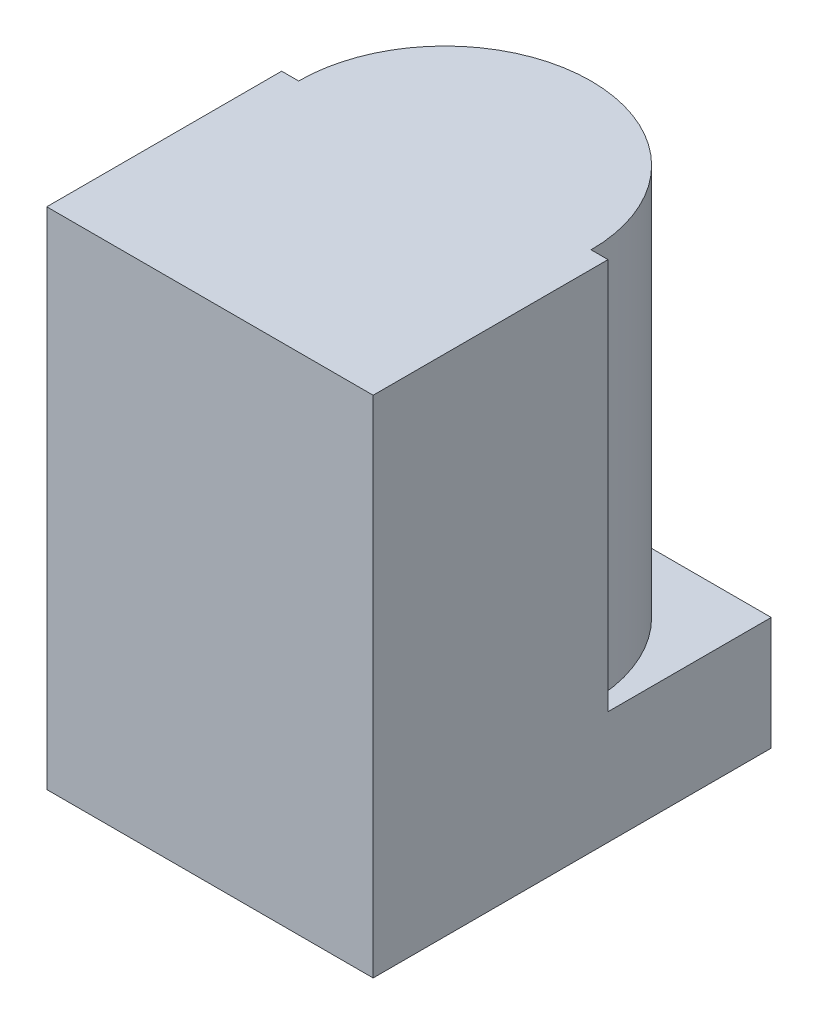
from build123d import *

# Parameters (mm, degrees)
SKETCH1_W           = 8.7884
SKETCH1_H           = 10.7188
BOSS_EXTRUDE1_DEPTH = 13.589
CUT_EXTRUDE1_DEPTH  = 10.541
SKETCH3_R           = 3.1115
SKETCH3_R_2         = 1.143
CUT_EXTRUDE2_DEPTH  = 11.049


with BuildPart() as part:
    # Sketch1 → Boss-Extrude1 (new body)
    with BuildSketch(Plane(origin=(0, 0, 0), x_dir=(1, 0, 0), z_dir=(0, 1, 0))):
        with Locations((4.3942, 5.3594)):
            Rectangle(SKETCH1_W, SKETCH1_H)
    extrude(amount=BOSS_EXTRUDE1_DEPTH)

    # Sketch2 → Cut-Extrude1 (cut)
    with BuildSketch(Plane(origin=(0, 13.589, 0), x_dir=(1, 0, 0), z_dir=(0, 1, 0))):
        with BuildLine():
            Line((0.4572, 6.3246), (0, 6.3246))
            Line((0, 6.3246), (0, 10.7188))
            Line((0, 10.7188), (8.7884, 10.7188))
            Line((8.7884, 10.7188), (8.7884, 6.3246))
            Line((8.7884, 6.3246), (8.3312, 6.3246))
            ThreePointArc((8.3312, 6.3246), (4.3942, 10.2616), (0.4572, 6.3246))
        make_face()
    extrude(amount=-CUT_EXTRUDE1_DEPTH, mode=Mode.SUBTRACT)

    # Sketch3 → Cut-Extrude2 (cut)
    with BuildSketch(Plane.XZ):
        with Locations(Location((4.3942, -6.3246, 0), (0, 0, 270))):
            Circle(SKETCH3_R)
        with Locations(Location((4.3942, -6.3246, 0), (0, 0, 270))):
            Circle(SKETCH3_R_2, mode=Mode.SUBTRACT)
    extrude(amount=-CUT_EXTRUDE2_DEPTH, mode=Mode.SUBTRACT)


solid = part.part
